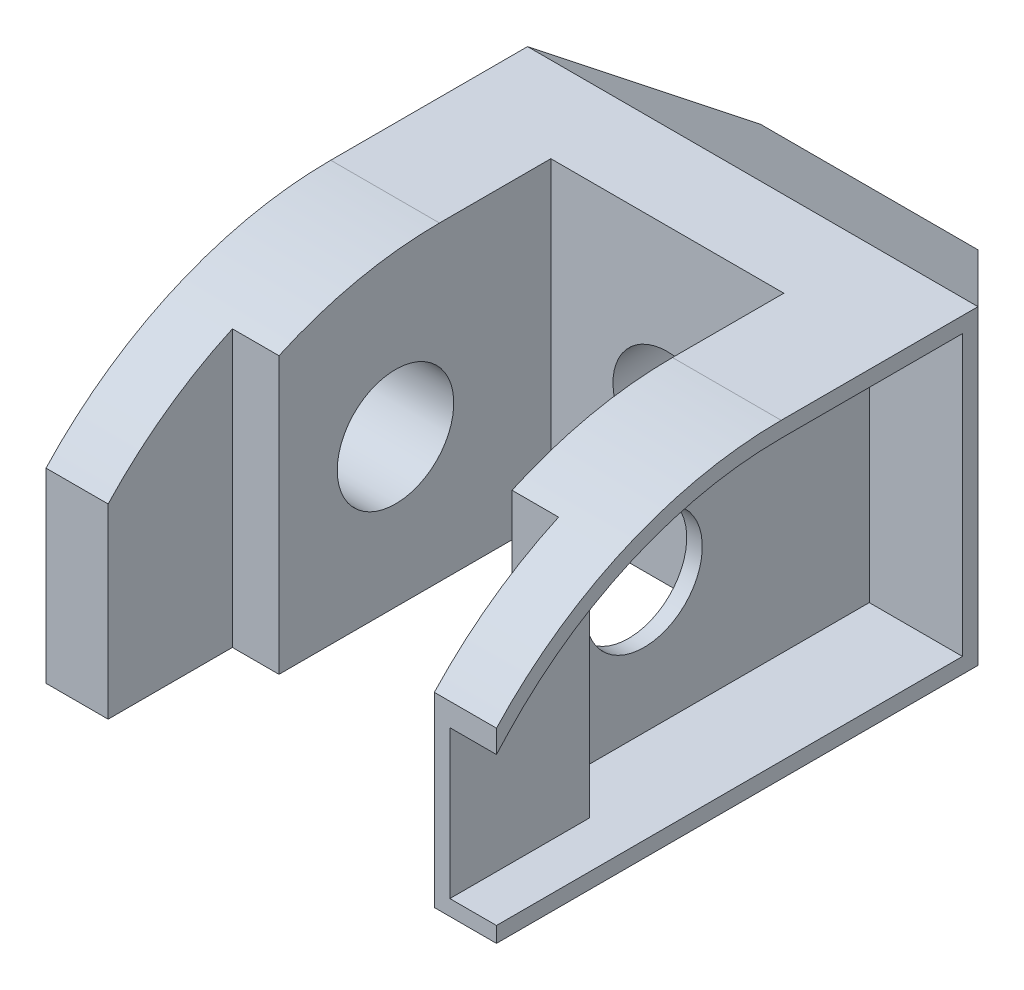
from build123d import *

# Parameters (mm, degrees)
SKETCH1_R           = 7.5
BOSS_EXTRUDE1_DEPTH = 29
CUT_EXTRUDE1_DEPTH  = 68.505555327
SKETCH3_R           = 7
CUT_EXTRUDE2_DEPTH  = 85.917607126
CUT_EXTRUDE3_DEPTH  = 68.505555438
CUT_EXTRUDE4_DEPTH  = 6
CUT_EXTRUDE5_DEPTH  = 6


with BuildPart() as part:
    # Sketch1 → Boss-Extrude1 (new, symmetric)
    with BuildSketch(Plane(origin=(0, 0, 0), x_dir=(0, 0, -1), z_dir=(1, 0, 0))):
        with BuildLine():
            Line((-31, 5), (-31, -19))
            Line((-31, -19), (31, -19))
            Line((31, -19), (46, -10.339745962))
            Line((46, -10.339745962), (46, 12.339745962))
            Line((46, 12.339745962), (31, 21))
            Line((31, 21), (5.66060556, 21))
            ThreePointArc((5.66060556, 21), (-14.33939444, 16.82575695), (-31, 5))
        make_face()
        with Locations(Location((0, 0, 0), (0, 0, 180))):
            Circle(SKETCH1_R, mode=Mode.SUBTRACT)
    extrude(amount=BOSS_EXTRUDE1_DEPTH, both=True)

    # Sketch2 → Cut-Extrude1 (cut, through all)
    with BuildSketch(Plane(origin=(0, 21, 0), x_dir=(1, 0, 0), z_dir=(0, 1, 0))):
        Polygon((-29, 31), (-14, 46), (-29, 46), align=None)
        Polygon((29, 31), (29, 46), (14, 46), align=None)
    extrude(amount=-CUT_EXTRUDE1_DEPTH, mode=Mode.SUBTRACT)

    # Sketch3 → Cut-Extrude2 (cut, through all)
    with BuildSketch(Plane(origin=(0, 0, -46), x_dir=(-1, 0, 0), z_dir=(0, 0, -1))):
        with Locations(Location((0, 0, 0), (0, 0, 90))):
            Circle(SKETCH3_R)
    extrude(amount=-CUT_EXTRUDE2_DEPTH, mode=Mode.SUBTRACT)

    # Sketch4 → Cut-Extrude3 (cut, through all)
    with BuildSketch(Plane(origin=(0, 21, 0), x_dir=(1, 0, 0), z_dir=(0, 1, 0))):
        Polygon((-21, -31), (21, -31), (21, -15), (15, -15), (15, 20), (-15, 20), (-15, -15), (-21, -15), align=None)
    extrude(amount=-CUT_EXTRUDE3_DEPTH, mode=Mode.SUBTRACT)

    # Sketch6 → Cut-Extrude4 (cut)
    with BuildSketch(Plane(origin=(29, 0, 0), x_dir=(0, 0, -1), z_dir=(1, 0, 0))):
        with BuildLine():
            Line((-31, 2.058823529), (-31, -17))
            Line((-31, -17), (29, -17))
            Line((29, -17), (29, 19))
            Line((29, 19), (5.66060556, 19))
            ThreePointArc((5.66060556, 19), (-13.53939444, 14.992726672), (-29.533575778, 3.64))
            Line((-29.533575778, 3.64), (-31, 2.058823529))
        make_face()
    extrude(amount=-CUT_EXTRUDE4_DEPTH, mode=Mode.SUBTRACT)

    # Sketch7 → Cut-Extrude5 (cut)
    with BuildSketch(Plane(origin=(23, 0, 0), x_dir=(0, 0, -1), z_dir=(1, 0, 0))):
        with BuildLine():
            Line((-13, -17), (29, -17))
            Line((29, -17), (29, 19))
            Line((29, 19), (5.66060556, 19))
            ThreePointArc((5.66060556, 19), (-3.858778616, 18.046586751), (-13, 15.224221872))
            Line((-13, 15.224221872), (-13, -17))
        make_face()
    extrude(amount=-CUT_EXTRUDE5_DEPTH, mode=Mode.SUBTRACT)


solid = part.part
